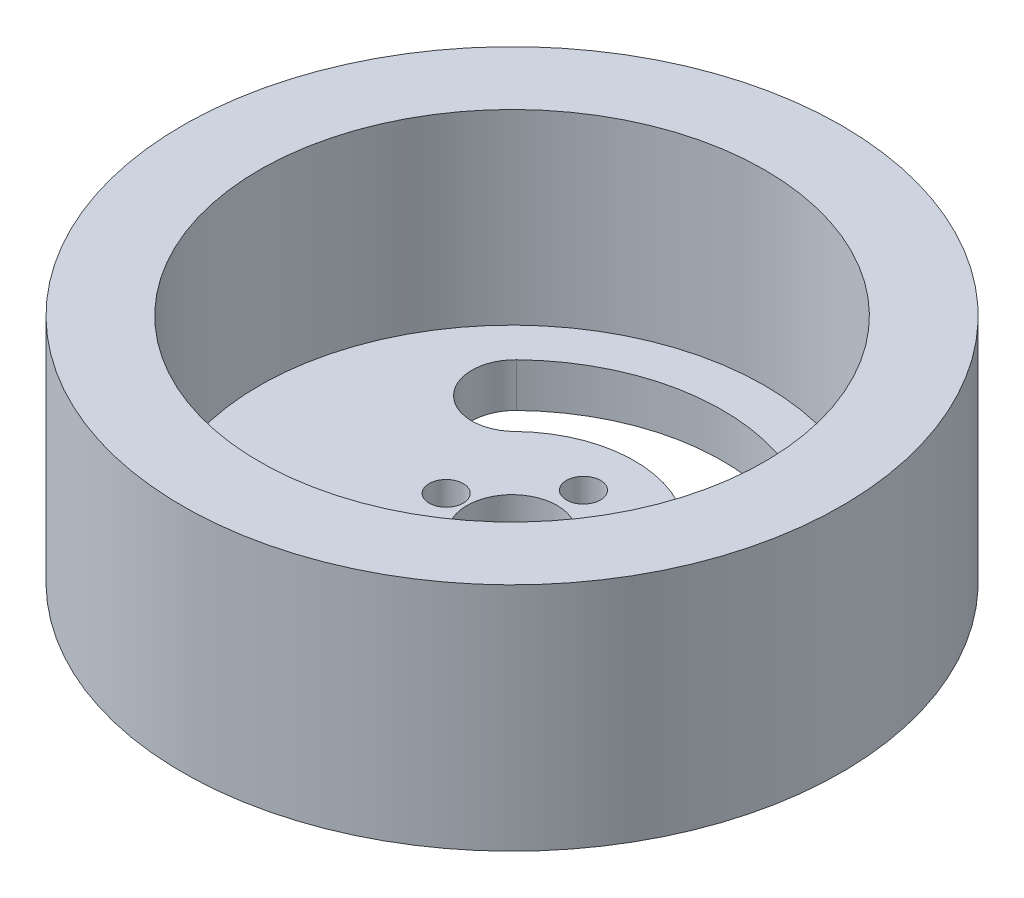
from build123d import *

# Parameters (mm, degrees)
SKETCH_1_R      = 30
SKETCH_1_R_2    = 23
EXTRUDE_1_DEPTH = 21
SKETCH_2_R      = 23
SKETCH_2_R_2    = 4.1
SKETCH_2_R_3    = 1.55
EXTRUDE_2_DEPTH = 4


with BuildPart() as part:
    # 草图1 → 凸台-拉伸1 (new body)
    with BuildSketch(Plane(origin=(0, 0, 0), x_dir=(1, 0, 0), z_dir=(0, 1, 0))):
        with Locations(Location((0, 0, 0), (0, 0, 90))):
            Circle(SKETCH_1_R)
        with Locations(Location((0, 0, 0), (0, 0, 90))):
            Circle(SKETCH_1_R_2, mode=Mode.SUBTRACT)
    extrude(amount=EXTRUDE_1_DEPTH)

    # 草图2 → 凸台-拉伸2 (add)
    with BuildSketch(Plane.XZ):
        with Locations(Location((0, 0, 0), (0, 0, 270))):
            Circle(SKETCH_2_R)
        with Locations(Location((0, 0, 0), (0, 0, 270))):
            Circle(SKETCH_2_R_2, mode=Mode.SUBTRACT)
        with Locations(Location((6, 0, 0), (0, 0, 270))):
            Circle(SKETCH_2_R_3, mode=Mode.SUBTRACT)
        with Locations(Location((-6, 0, 0), (0, 0, 270))):
            Circle(SKETCH_2_R_3, mode=Mode.SUBTRACT)
        with Locations(Location((0, 6.5, 0), (0, 0, 270))):
            Circle(SKETCH_2_R_3, mode=Mode.SUBTRACT)
        with Locations(Location((0, -6.5, 0), (0, 0, 270))):
            Circle(SKETCH_2_R_3, mode=Mode.SUBTRACT)
        with BuildLine():
            ThreePointArc((13.744660155, 13.324975875), (0.2967616, 19.141123201), (-13.324975875, 13.744660155))
            ThreePointArc((-13.324975875, 13.744660155), (-13.412668503, 8.088485652), (-7.756494001, 8.000793024))
            ThreePointArc((-7.756494001, 8.000793024), (0.172745496, 11.142084508), (8.000793024, 7.756494001))
            ThreePointArc((8.000793024, 7.756494001), (13.656967527, 7.668801373), (13.744660155, 13.324975875))
        make_face(mode=Mode.SUBTRACT)
        with BuildLine():
            ThreePointArc((13.744660155, -13.324975875), (0.2967616, -19.141123201), (-13.324975875, -13.744660155))
            ThreePointArc((-13.324975875, -13.744660155), (-13.412668503, -8.088485652), (-7.756494001, -8.000793024))
            ThreePointArc((-7.756494001, -8.000793024), (0.172745496, -11.142084508), (8.000793024, -7.756494001))
            ThreePointArc((8.000793024, -7.756494001), (13.656967527, -7.668801373), (13.744660155, -13.324975875))
        make_face(mode=Mode.SUBTRACT)
    extrude(amount=-EXTRUDE_2_DEPTH)


solid = part.part
